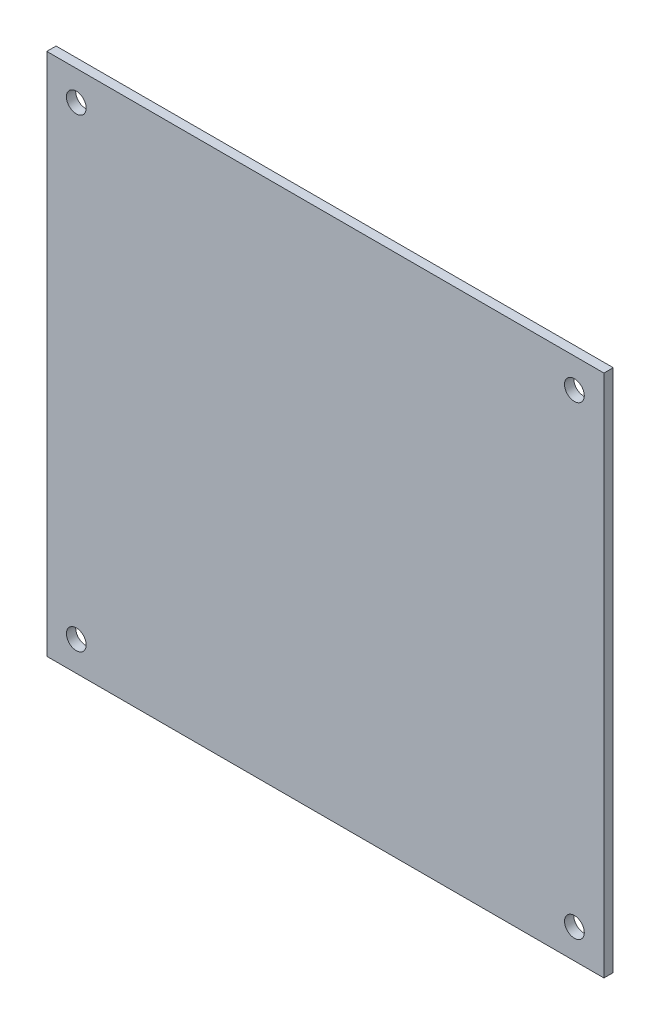
from build123d import *

# Parameters (mm, degrees)
BODY_SKETCH_W    = 95.89
BODY_SKETCH_H    = 90.17
BODY_DEPTH       = 1.6
HOLES_DEPTH      = 132.636169042
HOLES_DEPTH_BACK = 132.636169042
HOLES_SKETCH_R   = 1.7


with BuildPart() as part:
    # Body sketch → Body (new body)
    with BuildSketch(Plane.XY):
        with Locations((47.945, 45.085)):
            Rectangle(BODY_SKETCH_W, BODY_SKETCH_H)
    extrude(amount=BODY_DEPTH)

    # Holes sketch → Holes (cut, two sides: drawn at the far end of the back side and taken through both)
    with BuildSketch(Plane.XY.offset(-HOLES_DEPTH_BACK)):
        with Locations((5.08, 5.08)):
            Circle(HOLES_SKETCH_R)
        with Locations((90.81, 5.08)):
            Circle(HOLES_SKETCH_R)
        with Locations((5.08, 85.09)):
            Circle(HOLES_SKETCH_R)
        with Locations((90.81, 85.09)):
            Circle(HOLES_SKETCH_R)
    extrude(amount=HOLES_DEPTH + HOLES_DEPTH_BACK, mode=Mode.SUBTRACT)


solid = part.part
